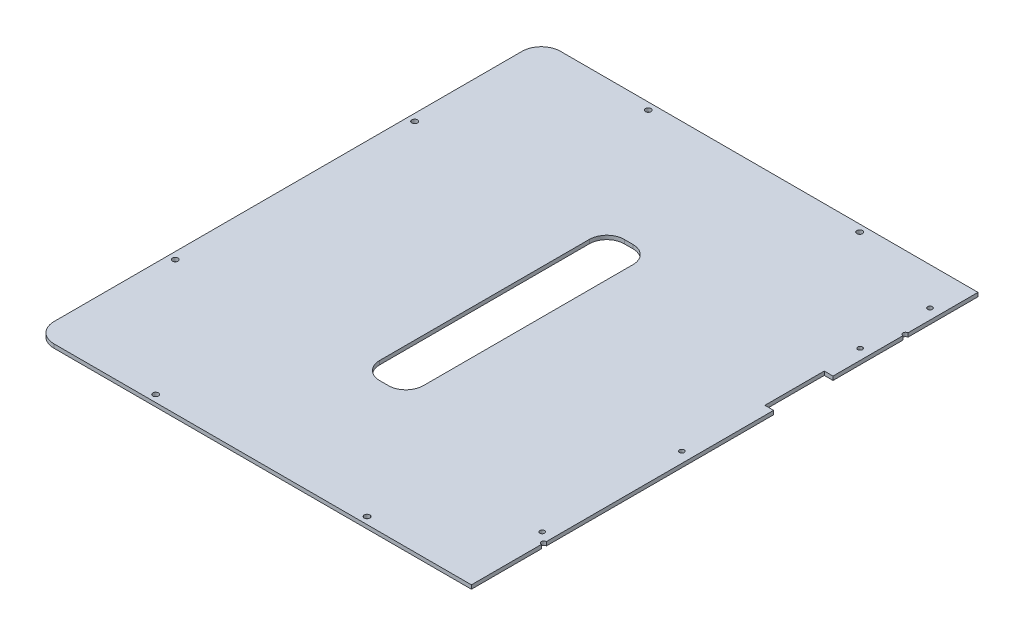
from build123d import *

# Parameters (mm, degrees)
SKETCH1_R           = 1.6
SKETCH1_R_2         = 1.4
SKETCH1_W           = 10
SKETCH1_H           = 34
BOSS_EXTRUDE1_DEPTH = 2.2
SKETCH2_R           = 1.35
CUT_EXTRUDE1_DEPTH  = 59.2
SKETCH4_W           = 288.577472545
SKETCH4_H           = 315.146932737
CUT_EXTRUDE2_DEPTH  = 2.2


with BuildPart() as part:
    # Sketch1 → Boss-Extrude1 (new body)
    with BuildSketch(Plane(origin=(0, 0, 0), x_dir=(1, 0, 0), z_dir=(0, 1, 0))):
        with BuildLine():
            Line((-239, 145), (239, 145))
            ThreePointArc((239, 145), (246.778174593, 141.778174593), (250, 134))
            Line((250, 134), (250, -134))
            ThreePointArc((250, -134), (246.778174593, -141.778174593), (239, -145))
            Line((239, -145), (-239, -145))
            ThreePointArc((-239, -145), (-246.778174593, -141.778174593), (-250, -134))
            Line((-250, -134), (-250, 134))
            ThreePointArc((-250, 134), (-246.778174593, 141.778174593), (-239, 145))
        make_face()
        with Locations(Location((63.75, 141, 0), (0, 0, 270))):
            Circle(SKETCH1_R, mode=Mode.SUBTRACT)
        with Locations(Location((184.75, 141, 0), (0, 0, 270))):
            Circle(SKETCH1_R, mode=Mode.SUBTRACT)
        with Locations(Location((246, 68.5, 0), (0, 0, 270))):
            Circle(SKETCH1_R, mode=Mode.SUBTRACT)
        with Locations(Location((0, 103.5, 0), (0, 0, 270))):
            Circle(SKETCH1_R_2, mode=Mode.SUBTRACT)
        with Locations(Location((0, -103.5, 0), (0, 0, 270))):
            Circle(SKETCH1_R_2, mode=Mode.SUBTRACT)
        with Locations(Location((-246, 68.5, 0), (0, 0, 90))):
            Circle(SKETCH1_R, mode=Mode.SUBTRACT)
        with Locations(Location((-184.75, 141, 0), (0, 0, 90))):
            Circle(SKETCH1_R, mode=Mode.SUBTRACT)
        with Locations(Location((-63.75, 141, 0), (0, 0, 90))):
            Circle(SKETCH1_R, mode=Mode.SUBTRACT)
        with Locations(Location((184.75, -141, 0), (0, 0, 90))):
            Circle(SKETCH1_R, mode=Mode.SUBTRACT)
        with Locations(Location((246, -68.5, 0), (0, 0, 90))):
            Circle(SKETCH1_R, mode=Mode.SUBTRACT)
        with Locations(Location((63.75, -141, 0), (0, 0, 90))):
            Circle(SKETCH1_R, mode=Mode.SUBTRACT)
        with Locations(Location((-63.75, -141, 0), (0, 0, 270))):
            Circle(SKETCH1_R, mode=Mode.SUBTRACT)
        with Locations(Location((-184.75, -141, 0), (0, 0, 270))):
            Circle(SKETCH1_R, mode=Mode.SUBTRACT)
        with Locations(Location((-246, -68.5, 0), (0, 0, 270))):
            Circle(SKETCH1_R, mode=Mode.SUBTRACT)
        with BuildLine():
            Line((-127.5, -70), (-122.5, -70))
            ThreePointArc((-122.5, -70), (-115.428932188, -67.071067812), (-112.5, -60))
            Line((-112.5, -60), (-112.5, 60))
            ThreePointArc((-112.5, 60), (-115.428932188, 67.071067812), (-122.5, 70))
            Line((-122.5, 70), (-127.5, 70))
            ThreePointArc((-127.5, 70), (-134.571067812, 67.071067812), (-137.5, 60))
            Line((-137.5, 60), (-137.5, -60))
            ThreePointArc((-137.5, -60), (-134.571067812, -67.071067812), (-127.5, -70))
        make_face(mode=Mode.SUBTRACT)
        with BuildLine():
            Line((122.5, -70), (127.5, -70))
            ThreePointArc((127.5, -70), (134.571067812, -67.071067812), (137.5, -60))
            Line((137.5, -60), (137.5, 60))
            ThreePointArc((137.5, 60), (134.571067812, 67.071067812), (127.5, 70))
            Line((127.5, 70), (122.5, 70))
            ThreePointArc((122.5, 70), (115.428932188, 67.071067812), (112.5, 60))
            Line((112.5, 60), (112.5, -60))
            ThreePointArc((112.5, -60), (115.428932188, -67.071067812), (122.5, -70))
        make_face(mode=Mode.SUBTRACT)
        with Locations((0, 45)):
            Rectangle(SKETCH1_W, SKETCH1_H, mode=Mode.SUBTRACT)
    extrude(amount=BOSS_EXTRUDE1_DEPTH)

    # Sketch2 → Cut-Extrude1 (cut)
    with BuildSketch(Plane(origin=(0, 2.2, 0), x_dir=(1, 0, 0), z_dir=(0, 1, 0))):
        with Locations(Location((-6, -18.5, 0), (0, 0, 270))):
            Circle(SKETCH2_R)
        with Locations(Location((6, -18.5, 0), (0, 0, 270))):
            Circle(SKETCH2_R)
        with Locations(Location((-6, -98.5, 0), (0, 0, 270))):
            Circle(SKETCH2_R)
        with Locations(Location((6, -98.5, 0), (0, 0, 270))):
            Circle(SKETCH2_R)
        with Locations(Location((-6, 123.5, 0), (0, 0, 270))):
            Circle(SKETCH2_R)
        with Locations(Location((6, 123.5, 0), (0, 0, 270))):
            Circle(SKETCH2_R)
        with Locations(Location((-6, 83.5, 0), (0, 0, 270))):
            Circle(SKETCH2_R)
        with Locations(Location((6, 83.5, 0), (0, 0, 270))):
            Circle(SKETCH2_R)
    extrude(amount=-CUT_EXTRUDE1_DEPTH, mode=Mode.SUBTRACT)

    # Sketch4 → Cut-Extrude2 (cut)
    with BuildSketch(Plane(origin=(0, 2.2, 0), x_dir=(1, 0, 0), z_dir=(0, 1, 0))):
        with Locations((144.288736273, -12.573466369)):
            Rectangle(SKETCH4_W, SKETCH4_H)
    extrude(amount=-CUT_EXTRUDE2_DEPTH, mode=Mode.SUBTRACT)


solid = part.part
